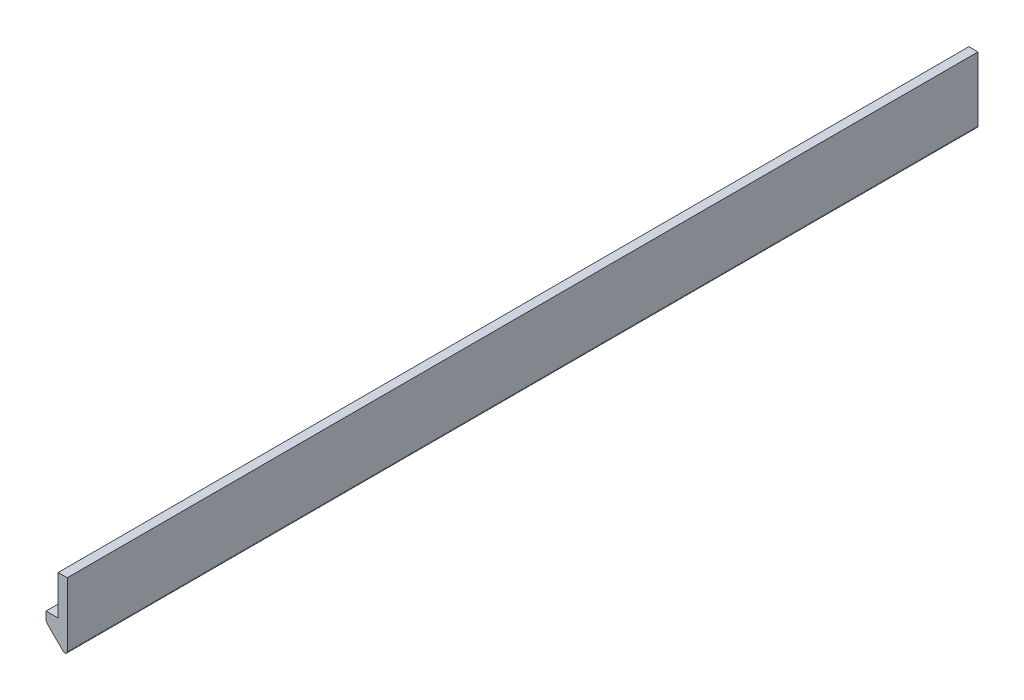
from build123d import *

# Parameters (mm, degrees)
BOSS_EXTRUDE1_DEPTH = 300
FILLET1_R           = 1.5
SKETCH2_W           = 20
SKETCH2_H           = 300
CUT_EXTRUDE1_DEPTH  = 10
FILLET2_R           = 0.8


with BuildPart() as part:
    # Sketch1 → Boss-Extrude1 (new body)
    with BuildSketch(Plane.XY.offset(280)):
        Polygon((-7, 4), (4, -7), (7, -7), (7, -3), (20, -3), (20, 0), (0, 0), (0, 20), (-3, 20), (-3, 7), (-7, 7), align=None)
    extrude(amount=-BOSS_EXTRUDE1_DEPTH)

    # Fillet1
    fillet1_edges = [part.edges().sort_by_distance(p)[0] for p in [
        (4, -7, 130),
        (-7, 4, 130),
    ]]
    fillet(fillet1_edges, radius=FILLET1_R)

    # Sketch2 → Cut-Extrude1 (cut)
    with BuildSketch(Plane(origin=(0, 0, 0), x_dir=(1, 0, 0), z_dir=(0, 1, 0))):
        with Locations((10, -130)):
            Rectangle(SKETCH2_W, SKETCH2_H)
    extrude(amount=-CUT_EXTRUDE1_DEPTH, mode=Mode.SUBTRACT)

    # Fillet2
    fillet2_edges = [part.edges().sort_by_distance(p)[0] for p in [
        (0, -3, 130),
    ]]
    fillet(fillet2_edges, radius=FILLET2_R)


solid = part.part
